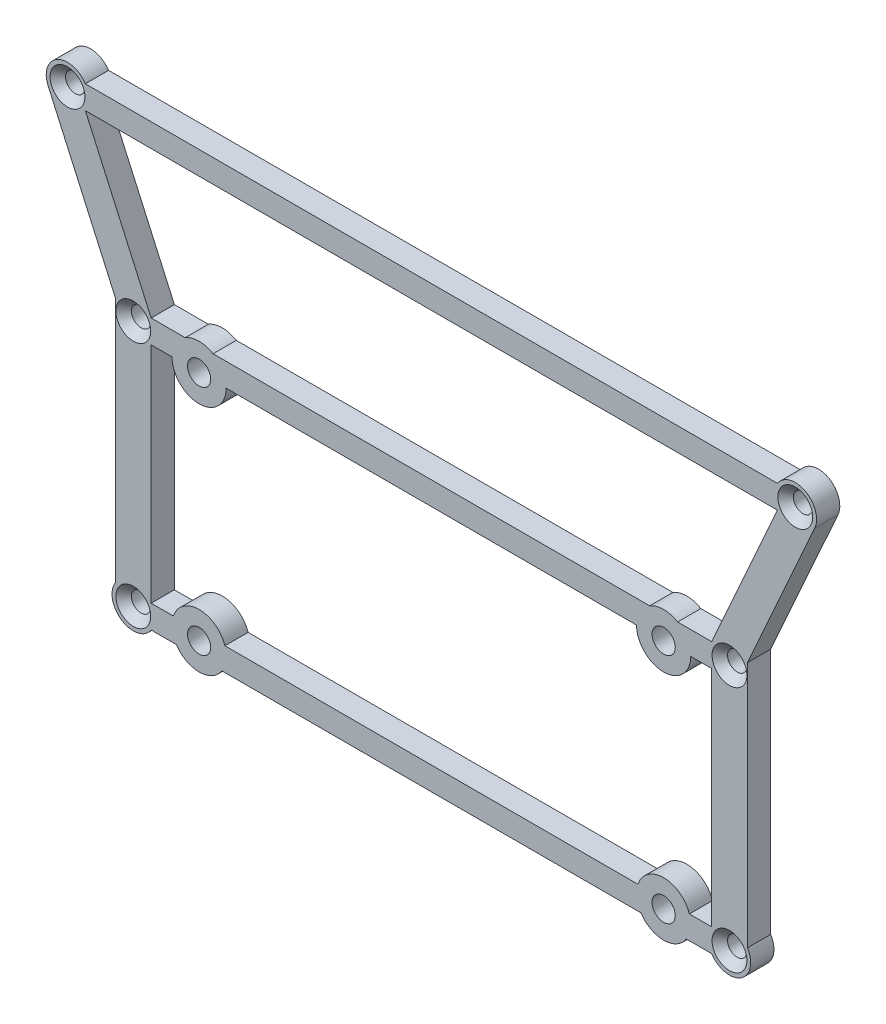
from build123d import *

# Parameters (mm, degrees)
SKETCH1_R           = 1.25
SKETCH1_W           = 72.390227772
SKETCH1_H           = 28.901521269
BOSS_EXTRUDE1_DEPTH = 3
CHAMFER1_SIZE       = 1
SKETCH2_R           = 3.5
BOSS_EXTRUDE2_DEPTH = 3
CUT_EXTRUDE1_DEPTH  = 3


with BuildPart() as part:
    # Sketch1 → Boss-Extrude1 (new body)
    with BuildSketch(Plane.XY):
        with BuildLine():
            Line((6.173773471, 33.368208058), (-2.509184891, 52.727938114))
            ThreePointArc((-2.509184891, 52.727938114), (-1.316660917, 56.267635348), (2.304886114, 55.353323017))
            Line((2.304886114, 55.353323017), (91.695113886, 55.353323017))
            ThreePointArc((91.695113886, 55.353323017), (95.316660917, 56.267635348), (96.509184891, 52.727938114))
            Line((96.509184891, 52.727938114), (87.826226529, 33.368208058))
            Line((87.826226529, 33.368208058), (87.826226529, 1.466686789))
            ThreePointArc((87.826226529, 1.466686789), (86.983381771, -2.315616229), (83.195113886, -1.5))
            Line((83.195113886, -1.5), (10.804886114, -1.5))
            ThreePointArc((10.804886114, -1.5), (7.016618229, -2.315616229), (6.173773471, 1.466686789))
            Line((6.173773471, 1.466686789), (6.173773471, 33.368208058))
        make_face()
        with Locations((0, 53.853323017)):
            Circle(SKETCH1_R, mode=Mode.SUBTRACT)
        with Locations((8.5, 31.901521269)):
            Circle(SKETCH1_R, mode=Mode.SUBTRACT)
        with Locations((8.5, 0)):
            Circle(SKETCH1_R, mode=Mode.SUBTRACT)
        with Locations(Location((85.5, 0, 0), (0, 0, 180))):
            Circle(SKETCH1_R, mode=Mode.SUBTRACT)
        with Locations(Location((85.5, 31.901521269, 0), (0, 0, 180))):
            Circle(SKETCH1_R, mode=Mode.SUBTRACT)
        with Locations(Location((94, 53.853323017, 0), (0, 0, 180))):
            Circle(SKETCH1_R, mode=Mode.SUBTRACT)
        Polygon((10.804886114, 33.401521269), (2.304886114, 52.353323017), (91.695113886, 52.353323017), (83.195113886, 33.401521269), align=None, mode=Mode.SUBTRACT)
        with Locations((47, 15.950760635)):
            Rectangle(SKETCH1_W, SKETCH1_H, mode=Mode.SUBTRACT)
    extrude(amount=BOSS_EXTRUDE1_DEPTH)

    # Chamfer1
    chamfer1_edges = [part.edges().sort_by_distance(p)[0] for p in [
        (-1.25, 53.853323017, 3),
        (7.25, 31.901521269, 3),
        (7.25, 0, 3),
        (86.75, 0, 3),
        (86.75, 31.901521269, 3),
        (95.25, 53.853323017, 3),
    ]]
    chamfer(chamfer1_edges, length=CHAMFER1_SIZE)

    # Sketch2 → Boss-Extrude2 (add)
    with BuildSketch(Plane.XY.offset(3)):
        with Locations((17, 30.401521269)):
            Circle(SKETCH2_R)
        with Locations((17, 0.401521269)):
            Circle(SKETCH2_R)
        with Locations((77, 30.401521269)):
            Circle(SKETCH2_R)
        with Locations((77, 0.401521269)):
            Circle(SKETCH2_R)
    extrude(amount=-BOSS_EXTRUDE2_DEPTH)

    # Sketch2<3> → Cut-Extrude1 (cut)
    with BuildSketch(Plane.XY.offset(3)):
        with BuildLine():
            Line((15.978557649, 1.5), (18.021442351, 1.5))
            ThreePointArc((18.021442351, 1.5), (17, 1.901521269), (15.978557649, 1.5))
        make_face()
        with BuildLine():
            ThreePointArc((18.5, 0.401521269), (18.375166086, 1.000619121), (18.021442351, 1.5))
            Line((18.021442351, 1.5), (15.978557649, 1.5))
            ThreePointArc((15.978557649, 1.5), (16.400902148, -0.973644817), (18.5, 0.401521269))
        make_face()
        with BuildLine():
            Line((15.5, 30.401521269), (18.5, 30.401521269))
            ThreePointArc((18.5, 30.401521269), (17, 31.901521269), (15.5, 30.401521269))
        make_face()
        with BuildLine():
            ThreePointArc((15.5, 30.401521269), (17, 28.901521269), (18.5, 30.401521269))
            Line((18.5, 30.401521269), (15.5, 30.401521269))
        make_face()
        with BuildLine():
            Line((78.5, 30.401521269), (75.5, 30.401521269))
            ThreePointArc((75.5, 30.401521269), (77, 28.901521269), (78.5, 30.401521269))
        make_face()
        with BuildLine():
            ThreePointArc((78.5, 30.401521269), (77, 31.901521269), (75.5, 30.401521269))
            Line((75.5, 30.401521269), (78.5, 30.401521269))
        make_face()
        with BuildLine():
            Line((78.021442351, 1.5), (75.978557649, 1.5))
            ThreePointArc((75.978557649, 1.5), (76.400902148, -0.973644817), (78.5, 0.401521269))
            ThreePointArc((78.5, 0.401521269), (78.375166086, 1.000619121), (78.021442351, 1.5))
        make_face()
        with BuildLine():
            ThreePointArc((78.021442351, 1.5), (77, 1.901521269), (75.978557649, 1.5))
            Line((75.978557649, 1.5), (78.021442351, 1.5))
        make_face()
    extrude(amount=-CUT_EXTRUDE1_DEPTH, mode=Mode.SUBTRACT)


solid = part.part
